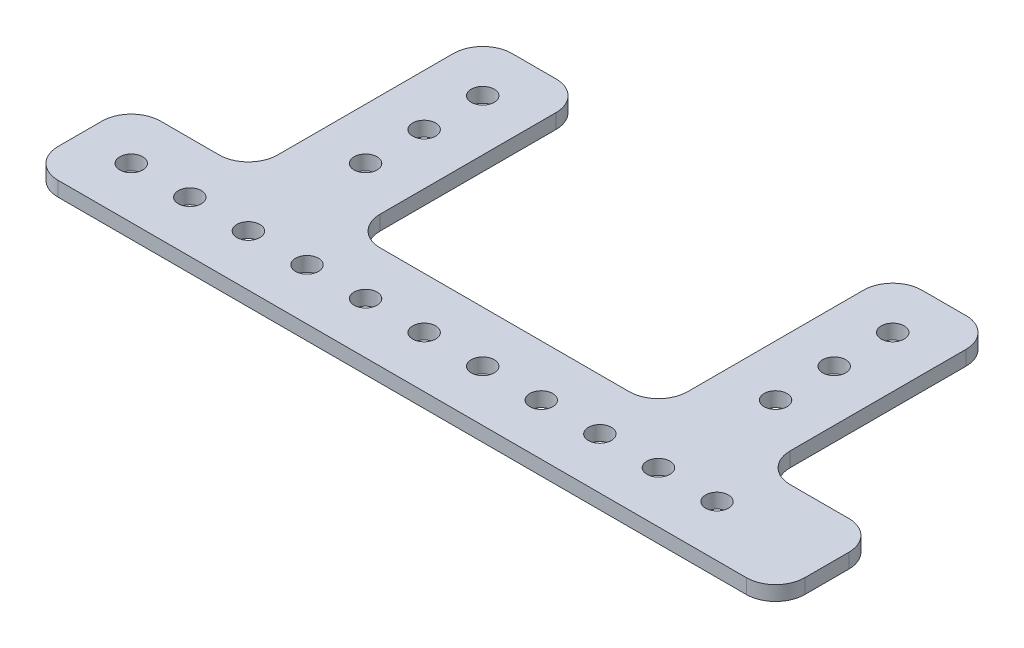
from build123d import *

# Parameters (mm, degrees)
SKETCH1_R           = 2.4892
BOSS_EXTRUDE1_DEPTH = 1.5875
FILLET1_R           = 6.35


with BuildPart() as part:
    # Sketch1 → Boss-Extrude1 (new, symmetric)
    with BuildSketch(Plane(origin=(0, 0, 0), x_dir=(1, 0, 0), z_dir=(0, 1, 0))):
        Polygon((-33.3375, 23.8125), (-33.3375, 74.6125), (-55.5625, 74.6125), (-55.5625, 23.8125), (-80.9625, 23.8125), (-80.9625, 1.5875), (80.9625, 1.5875), (80.9625, 23.8125), (55.5625, 23.8125), (55.5625, 74.6125), (33.3375, 74.6125), (33.3375, 23.8125), align=None)
        with Locations(Location((44.45, 50.8, 0), (0, 0, 270))):
            Circle(SKETCH1_R, mode=Mode.SUBTRACT)
        with Locations(Location((-69.85, 12.7, 0), (0, 0, 270))):
            Circle(SKETCH1_R, mode=Mode.SUBTRACT)
        with Locations(Location((-57.15, 12.7, 0), (0, 0, 270))):
            Circle(SKETCH1_R, mode=Mode.SUBTRACT)
        with Locations(Location((-44.45, 12.7, 0), (0, 0, 270))):
            Circle(SKETCH1_R, mode=Mode.SUBTRACT)
        with Locations(Location((-31.75, 12.7, 0), (0, 0, 270))):
            Circle(SKETCH1_R, mode=Mode.SUBTRACT)
        with Locations(Location((-19.05, 12.7, 0), (0, 0, 270))):
            Circle(SKETCH1_R, mode=Mode.SUBTRACT)
        with Locations(Location((-6.35, 12.7, 0), (0, 0, 270))):
            Circle(SKETCH1_R, mode=Mode.SUBTRACT)
        with Locations(Location((6.35, 12.7, 0), (0, 0, 270))):
            Circle(SKETCH1_R, mode=Mode.SUBTRACT)
        with Locations(Location((19.05, 12.7, 0), (0, 0, 270))):
            Circle(SKETCH1_R, mode=Mode.SUBTRACT)
        with Locations(Location((31.75, 12.7, 0), (0, 0, 270))):
            Circle(SKETCH1_R, mode=Mode.SUBTRACT)
        with Locations(Location((44.45, 12.7, 0), (0, 0, 270))):
            Circle(SKETCH1_R, mode=Mode.SUBTRACT)
        with Locations(Location((57.15, 12.7, 0), (0, 0, 270))):
            Circle(SKETCH1_R, mode=Mode.SUBTRACT)
        with Locations(Location((-44.45, 38.1, 0), (0, 0, 270))):
            Circle(SKETCH1_R, mode=Mode.SUBTRACT)
        with Locations(Location((-44.45, 50.8, 0), (0, 0, 270))):
            Circle(SKETCH1_R, mode=Mode.SUBTRACT)
        with Locations(Location((-44.45, 63.5, 0), (0, 0, 270))):
            Circle(SKETCH1_R, mode=Mode.SUBTRACT)
        with Locations(Location((44.45, 38.1, 0), (0, 0, 270))):
            Circle(SKETCH1_R, mode=Mode.SUBTRACT)
        with Locations(Location((44.45, 63.5, 0), (0, 0, 270))):
            Circle(SKETCH1_R, mode=Mode.SUBTRACT)
    extrude(amount=BOSS_EXTRUDE1_DEPTH, both=True)

    # Fillet1
    fillet1_edges = [part.edges().sort_by_distance(p)[0] for p in [
        (-33.3375, 0, -23.8125),
        (33.3375, 0, -23.8125),
        (33.3375, 0, -74.6125),
        (55.5625, 0, -74.6125),
        (55.5625, 0, -23.8125),
        (80.9625, 0, -23.8125),
        (80.9625, 0, -1.5875),
        (-80.9625, 0, -1.5875),
        (-80.9625, 0, -23.8125),
        (-55.5625, 0, -23.8125),
        (-55.5625, 0, -74.6125),
        (-33.3375, 0, -74.6125),
    ]]
    fillet(fillet1_edges, radius=FILLET1_R)


solid = part.part
